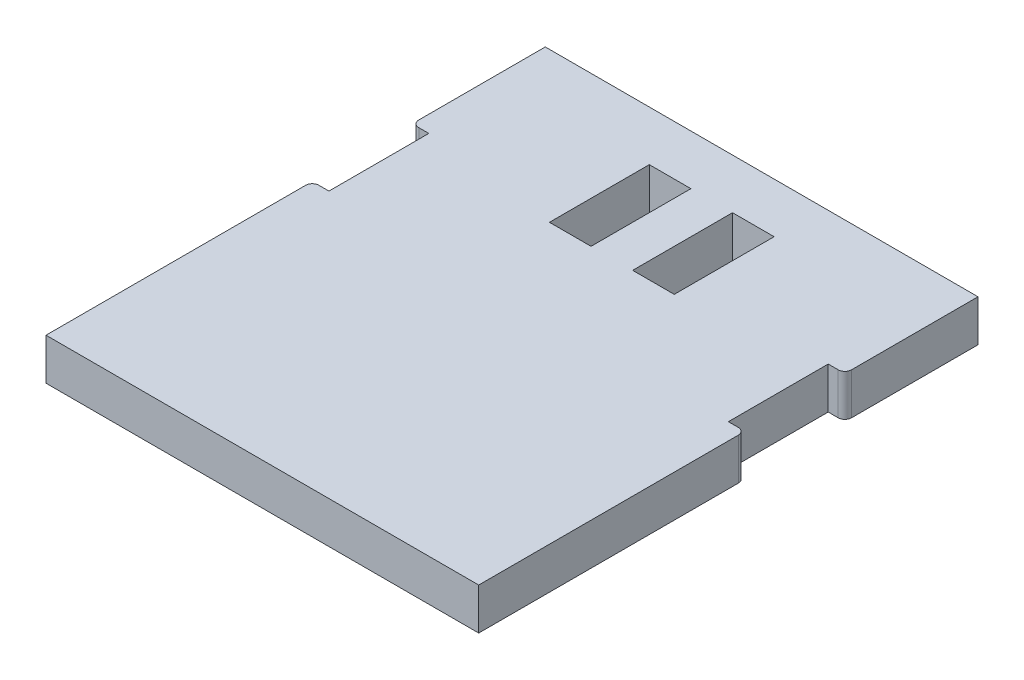
from build123d import *

# Parameters (mm, degrees)
SKETCH1_W           = 33.02
SKETCH1_H           = 38.1
SKETCH1_W_2         = 3.175
SKETCH1_H_2         = 7.62
BOSS_EXTRUDE1_DEPTH = 3.175
SKETCH5_W           = 1.27
SKETCH5_H           = 7.62
CUT_EXTRUDE3_DEPTH  = 51.517432882
FILLET2_R           = 0.508


with BuildPart() as part:
    # Sketch1 → Boss-Extrude1 (new body)
    with BuildSketch(Plane(origin=(0, 0, 0), x_dir=(1, 0, 0), z_dir=(0, 1, 0))):
        with Locations((16.51, 19.05)):
            Rectangle(SKETCH1_W, SKETCH1_H)
        with Locations((13.335, 30.48)):
            Rectangle(SKETCH1_W_2, SKETCH1_H_2, mode=Mode.SUBTRACT)
        with Locations((19.685, 30.48)):
            Rectangle(SKETCH1_W_2, SKETCH1_H_2, mode=Mode.SUBTRACT)
    extrude(amount=BOSS_EXTRUDE1_DEPTH)

    # Sketch5 → Cut-Extrude3 (cut, through all)
    with BuildSketch(Plane.XZ):
        with Locations((32.385, -24.13)):
            Rectangle(SKETCH5_W, SKETCH5_H)
        with Locations((0.635, -24.13)):
            Rectangle(SKETCH5_W, SKETCH5_H)
    extrude(amount=-CUT_EXTRUDE3_DEPTH, mode=Mode.SUBTRACT)

    # Fillet2
    fillet2_edges = [part.edges().sort_by_distance(p)[0] for p in [
        (33.02, 1.5875, -20.32),
        (33.02, 1.5875, -27.94),
        (0, 1.5875, -27.94),
        (0, 1.5875, -20.32),
    ]]
    fillet(fillet2_edges, radius=FILLET2_R)


solid = part.part
